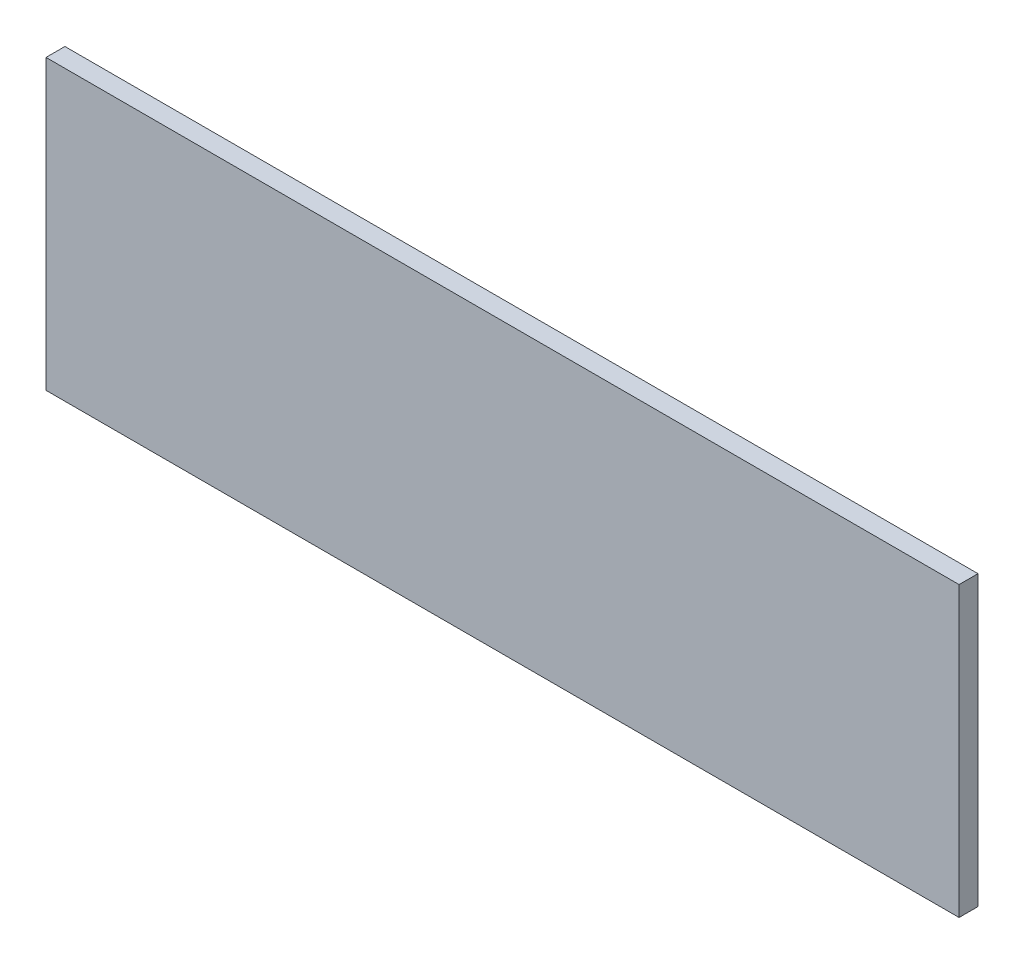
from build123d import *

# Parameters (mm, degrees)
CROQUIS1_W              = 48.26
CROQUIS1_H              = 15.24
SALIENTE_EXTRUIR1_DEPTH = 0.5


with BuildPart() as part:
    # Croquis1 → Saliente-Extruir1 (new, symmetric)
    with BuildSketch(Plane.XY):
        Rectangle(CROQUIS1_W, CROQUIS1_H)
    extrude(amount=SALIENTE_EXTRUIR1_DEPTH, both=True)


solid = part.part
